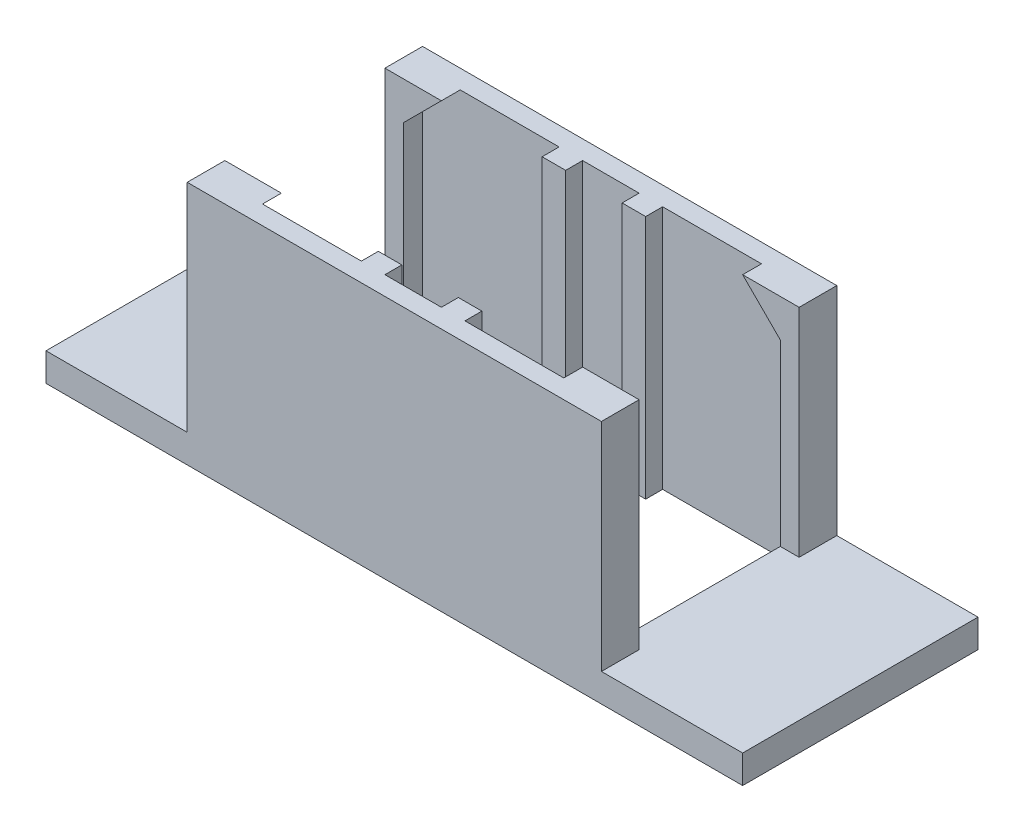
from build123d import *

# Parameters (mm, degrees)
SKETCH1_W           = 44
SKETCH1_H           = 25
SKETCH1_W_2         = 40
SKETCH1_H_2         = 21
BOSS_EXTRUDE1_DEPTH = 26
BOSS_EXTRUDE2_DEPTH = 2
SKETCH3_W           = 17
SKETCH3_H           = 23
CUT_EXTRUDE1_DEPTH  = 57
SKETCH4_W           = 2.5
SKETCH4_H           = 1.8
BOSS_EXTRUDE3_DEPTH = 26
SKETCH8_W           = 25
SKETCH8_H           = 3
BOSS_EXTRUDE5_DEPTH = 15
SKETCH9_W           = 25
SKETCH9_H           = 3
BOSS_EXTRUDE6_DEPTH = 15


with BuildPart() as part:
    # Sketch1 → Boss-Extrude1 (new body)
    with BuildSketch(Plane(origin=(0, 0, 0), x_dir=(1, 0, 0), z_dir=(0, 1, 0))):
        with Locations((-20, 10.5)):
            Rectangle(SKETCH1_W, SKETCH1_H)
        with Locations((-20, 10.5)):
            Rectangle(SKETCH1_W_2, SKETCH1_H_2, mode=Mode.SUBTRACT)
    extrude(amount=BOSS_EXTRUDE1_DEPTH)

    # Sketch2 → Boss-Extrude2 (add)
    with BuildSketch(Plane.XY.offset(-21)):
        Polygon((-40, 22), (-36, 26), (-40, 26), align=None)
        Polygon((0, 26), (0, 22), (-4, 26), align=None)
    boss_extrude2 = extrude(amount=BOSS_EXTRUDE2_DEPTH)

    # Mirror1: Boss-Extrude2 across plane
    add(boss_extrude2.mirror(Plane(origin=(0, 0, -10.5), x_dir=(1, 0, 0), z_dir=(0, 0, -1))))

    # Sketch3 → Cut-Extrude1 (cut, symmetric)
    with BuildSketch(Plane(origin=(-40, 0, 0), x_dir=(0, 0, -1), z_dir=(1, 0, 0))):
        with Locations((10.5, 14.5)):
            Rectangle(SKETCH3_W, SKETCH3_H)
    extrude(amount=CUT_EXTRUDE1_DEPTH, both=True, mode=Mode.SUBTRACT)

    # Sketch4 → Boss-Extrude3 (add)
    with BuildSketch(Plane.XZ):
        with Locations((-24.25, -0.9)):
            Rectangle(SKETCH4_W, SKETCH4_H)
        with Locations((-15.75, -0.9)):
            Rectangle(SKETCH4_W, SKETCH4_H)
        with Locations((-15.75, -20.1)):
            Rectangle(SKETCH4_W, SKETCH4_H)
        with Locations((-24.25, -20.1)):
            Rectangle(SKETCH4_W, SKETCH4_H)
    extrude(amount=-BOSS_EXTRUDE3_DEPTH)

    # Sketch8 → Boss-Extrude5 (add)
    with BuildSketch(Plane(origin=(2, 0, 0), x_dir=(0, 0, -1), z_dir=(1, 0, 0))):
        with Locations((10.5, 1.5)):
            Rectangle(SKETCH8_W, SKETCH8_H)
    extrude(amount=BOSS_EXTRUDE5_DEPTH)

    # Sketch9 → Boss-Extrude6 (add)
    with BuildSketch(Plane.ZY.offset(42)):
        with Locations((-10.5, 1.5)):
            Rectangle(SKETCH9_W, SKETCH9_H)
    extrude(amount=BOSS_EXTRUDE6_DEPTH)


solid = part.part
